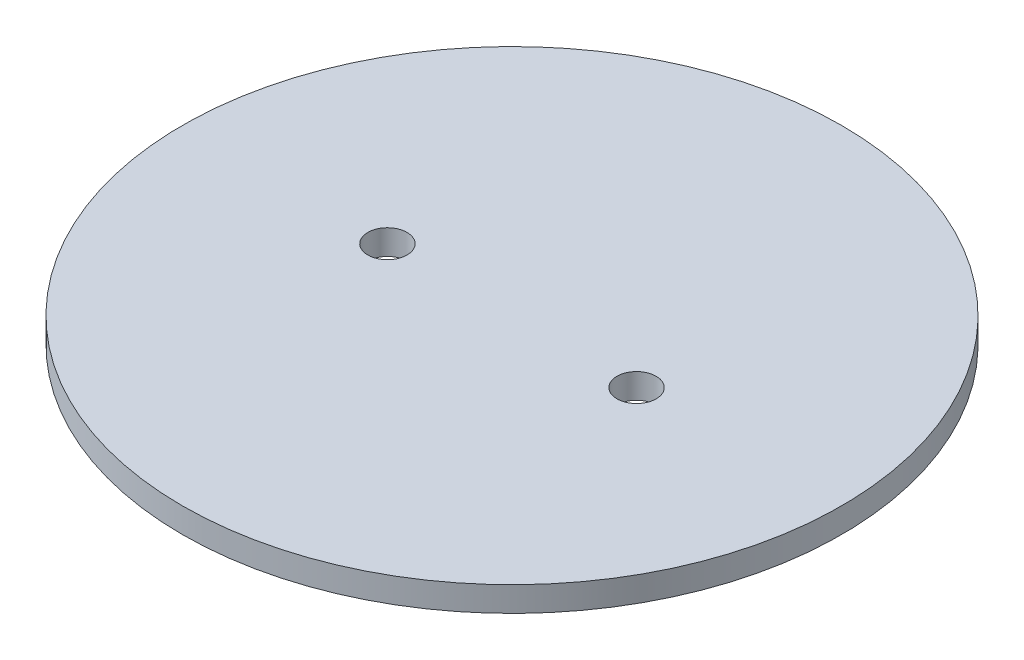
from build123d import *

# Parameters (mm, degrees)
SKETCH1_R           = 33.625439164
SKETCH1_R_2         = 2
BOSS_EXTRUDE1_DEPTH = 2.54


with BuildPart() as part:
    # Sketch1 → Boss-Extrude1 (new body)
    with BuildSketch(Plane(origin=(0, 0, 0), x_dir=(1, 0, 0), z_dir=(0, 1, 0))):
        with Locations(Location((33.663682442, -33.653738577, 0), (0, 0, 270))):
            Circle(SKETCH1_R)
        with Locations(Location((20.953678893, -33.653738577, 0), (0, 0, 270))):
            Circle(SKETCH1_R_2, mode=Mode.SUBTRACT)
        with Locations(Location((46.373685991, -33.653738577, 0), (0, 0, 90))):
            Circle(SKETCH1_R_2, mode=Mode.SUBTRACT)
    extrude(amount=BOSS_EXTRUDE1_DEPTH)


solid = part.part
